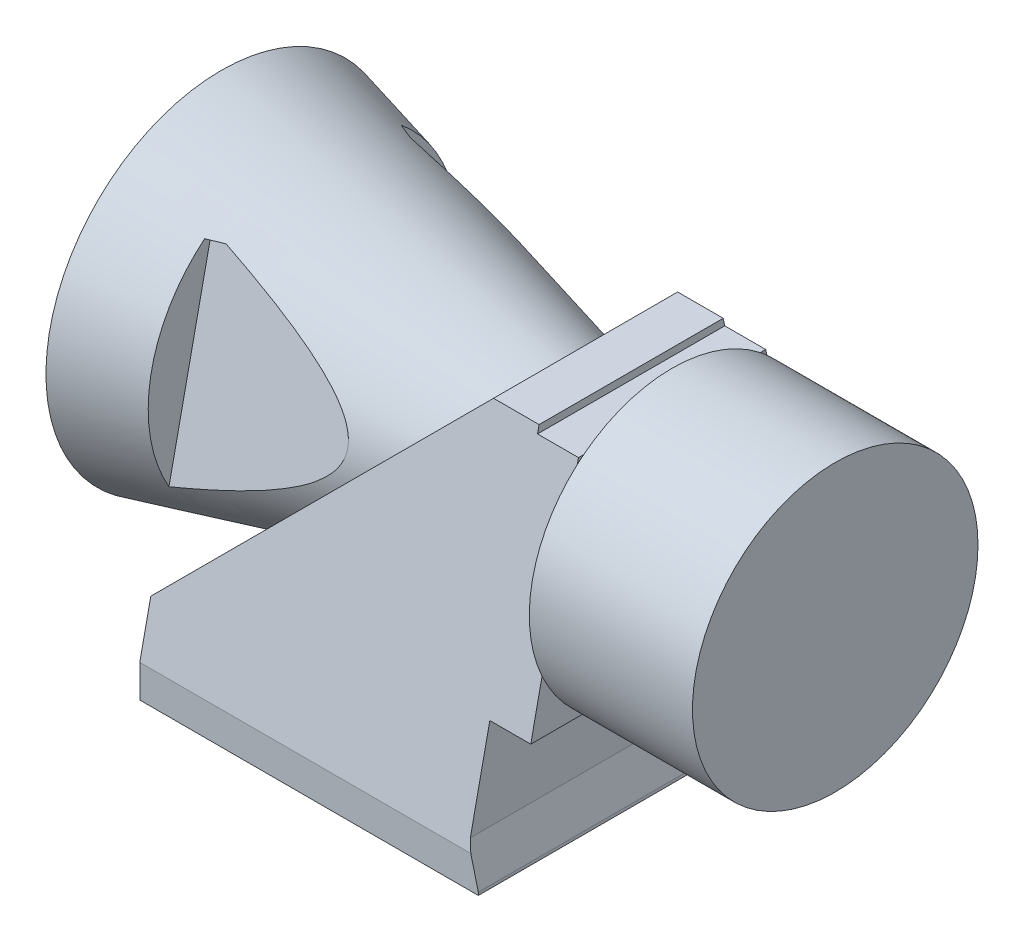
from build123d import *

# Parameters (mm, degrees)
EXTRUDE_1_DEPTH     = 80
SKETCH_2_R          = 35
EXTRUDE_2_DEPTH     = 40
CUT_EXTRUDE_START   = -90.5
CUT_EXTRUDE_1_DEPTH = 90.5


with BuildPart() as part:
    # 草图1 → 凸台-拉伸1 (new body)
    with BuildSketch(Plane.XY):
        Polygon((0, 0), (0, 20), (69.3, 89.3), (80.466666667, 89.3), (80.466666667, 87.5), (90.5, 87.5), (90.5, 32.5), (80.466666667, 32.5), (80.466666667, 10), (83, 0), (83, -0.7), (0, -0.7), align=None)
    extrude(amount=EXTRUDE_1_DEPTH)

    # 草图2 → 凸台-拉伸2 (add)
    with BuildSketch(Plane(origin=(90.5, 0, 0), x_dir=(0, 0, -1), z_dir=(1, 0, 0))):
        with Locations(Location((-40, 60, 0), (0, 0, 128.213210702))):
            Circle(SKETCH_2_R)
    extrude(amount=EXTRUDE_2_DEPTH)


with BuildPart() as body_2:
    # 草图3 → 旋转1 (revolve)
    with BuildSketch(Plane.XY.offset(40)):
        Polygon((92.5, 60), (92.5, 74.5), (-20, 103), (-20, 60), align=None)
    revolve(axis=Axis((92.5, 60, 40), (-1, 0, 0)))


with BuildPart() as cut_extrude_1_tool:
    # 草图5 → 切除-拉伸1 (new body)
    with BuildSketch(Plane.ZY.offset(CUT_EXTRUDE_START)):
        Polygon((0, 7.3), (17.429638057, 89.3), (0, 89.3), align=None)
        Polygon((62.570361943, 89.3), (80, 7.3), (80, 89.3), align=None)
    extrude(amount=CUT_EXTRUDE_1_DEPTH)


with BuildPart() as part_1:
    add(part.part)

    # 切除-拉伸1: cut by cut_extrude_1_tool
    add(cut_extrude_1_tool.part, mode=Mode.SUBTRACT)


with BuildPart() as body_2_1:
    add(body_2.part)

    # 切除-拉伸1: cut by cut_extrude_1_tool
    add(cut_extrude_1_tool.part, mode=Mode.SUBTRACT)


solid = Compound([part_1.part, body_2_1.part])
